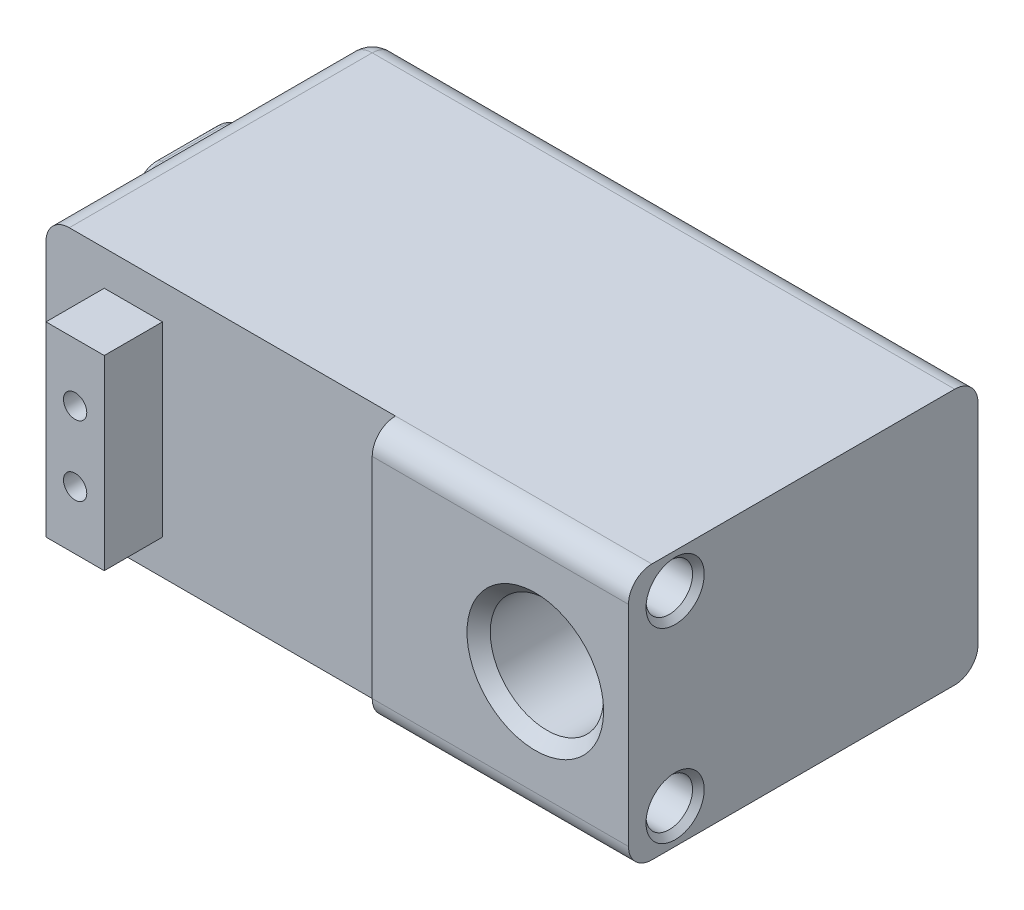
from build123d import *

# Parameters (mm, degrees)
SKETCH_1_W                = 52
SKETCH_1_H                = 30
EXTRUDE_1_DEPTH           = 22
SKETCH_2_W                = 30
SKETCH_2_H                = 2
CUT_EXTRUDE_1_DEPTH       = 64.937469453
EXTRUDE_2_DEPTH           = 4
SKETCH_4_W                = 5
SKETCH_4_H                = 16
EXTRUDE_3_DEPTH           = 5
HOLE_WIZARD_4_0_4_1_D     = 4
HOLE_WIZARD_4_0_4_1_DEPTH = 6
HOLE_WIZARD_M81_D         = 9.728
HOLE_WIZARD_M81_DEPTH     = 33
HOLE_WIZARD_2_0_2_1_D     = 2
HOLE_WIZARD_2_0_2_1_DEPTH = 2
FILLET_1_R                = 2
CHAMFER_1_SIZE            = 1
CHAMFER_2_SIZE            = 0.5
FILLET_2_R                = 0.5


with BuildPart() as part:
    # Эскиз1 → Бобышка-Вытянуть1 (new body)
    with BuildSketch(Plane(origin=(0, 22, 0), x_dir=(1, 0, 0), z_dir=(0, 1, 0))):
        with Locations((-26, 15)):
            Rectangle(SKETCH_1_W, SKETCH_1_H)
    extrude(amount=-EXTRUDE_1_DEPTH)

    # Эскиз2 → Вырез-Вытянуть1 (cut, through all)
    with BuildSketch(Plane.XZ):
        with Locations((-37, -1)):
            Rectangle(SKETCH_2_W, SKETCH_2_H)
    extrude(amount=-CUT_EXTRUDE_1_DEPTH, mode=Mode.SUBTRACT)

    # Эскиз3 → Бобышка-Вытянуть2 (add)
    with BuildSketch(Plane.ZY.offset(52)):
        Polygon((-14.25, 17.495190528), (-10.5, 11), (-14.25, 4.504809472), (-21.75, 4.504809472), (-25.5, 11), (-21.75, 17.495190528), align=None)
    extrude(amount=EXTRUDE_2_DEPTH)

    # Эскиз4 → Бобышка-Вытянуть3 (add)
    with BuildSketch(Plane.XY.offset(-2)):
        with Locations((-44.5, 11)):
            Rectangle(SKETCH_4_W, SKETCH_4_H)
    extrude(amount=EXTRUDE_3_DEPTH)

    # Диаметр отверстия Ø4.0 (4)1
    with Locations(Plane(origin=(0, 0, 0), x_dir=(0, 0, -1), z_dir=(1, 0, 0))):
        with Locations((4, 3), (4, 19)):
            Hole(HOLE_WIZARD_4_0_4_1_D / 2, depth=HOLE_WIZARD_4_0_4_1_DEPTH)

    # Отверстие с зазором M81
    with Locations(Plane(origin=(0, 0, -30), x_dir=(-1, 0, 0), z_dir=(0, 0, -1))):
        with Locations((8, 11)):
            Hole(HOLE_WIZARD_M81_D / 2, depth=HOLE_WIZARD_M81_DEPTH)

    # Диаметр отверстия Ø2.0 (2)1
    with Locations(Plane.XY.offset(3)):
        with Locations((-44.5, 14), (-44.5, 8)):
            Hole(HOLE_WIZARD_2_0_2_1_D / 2, depth=HOLE_WIZARD_2_0_2_1_DEPTH)

    # Эскиз11 → Диаметр отверстия Ø8.0 (8)1 (revolve, cut)
    with BuildSketch(Plane(origin=(-56, 11, -18), x_dir=(0, 0, 1), z_dir=(0, 1, 0))):
        Polygon((0, 0), (0, 2), (4, 2), (4, 1), (5, 0), align=None)
    revolve(axis=Axis((-62.35, 11, -18), (1, 0, 0)), mode=Mode.SUBTRACT)

    # Скругление1
    fillet_1_edges = [part.edges().sort_by_distance(p)[0] for p in [
        (-52, 0, -16),
        (-26, 0, -30),
        (-52, 11, -30),
        (-26, 22, -30),
        (-52, 22, -16),
        (-11, 22, 0),
        (-11, 0, 0),
        (-54, 17.495190528, -21.75),
        (-54, 11, -25.5),
        (-54, 17.495190528, -14.25),
        (-54, 11, -10.5),
        (-54, 4.504809472, -14.25),
        (-54, 4.504809472, -21.75),
    ]]
    fillet(fillet_1_edges, radius=FILLET_1_R)

    # Фаска1
    chamfer_1_edges = [part.edges().sort_by_distance(p)[0] for p in [
        (-12.864, 11, 0),
        (-12.864, 11, -30),
    ]]
    chamfer(chamfer_1_edges, length=CHAMFER_1_SIZE)

    # Фаска2
    chamfer_2_edges = [part.edges().sort_by_distance(p)[0] for p in [
        (0, 19, -6),
        (0, 3, -6),
    ]]
    chamfer(chamfer_2_edges, length=CHAMFER_2_SIZE)

    # Скругление2
    fillet_2_edges = [part.edges().sort_by_distance(p)[0] for p in [
        (-56, 14.247595264, -23.625),
        (-56, 17.495190528, -18),
        (-56, 7.752404736, -23.625),
        (-56, 4.504809472, -18),
        (-56, 7.752404736, -12.375),
        (-56, 14.247595264, -12.375),
        (-56, 4.772758664, -21.595299462),
        (-56, 4.772758664, -14.404700538),
        (-56, 11, -10.809401077),
        (-56, 17.227241336, -14.404700538),
        (-56, 11, -25.190598923),
        (-56, 17.227241336, -21.595299462),
    ]]
    fillet(fillet_2_edges, radius=FILLET_2_R)


solid = part.part
